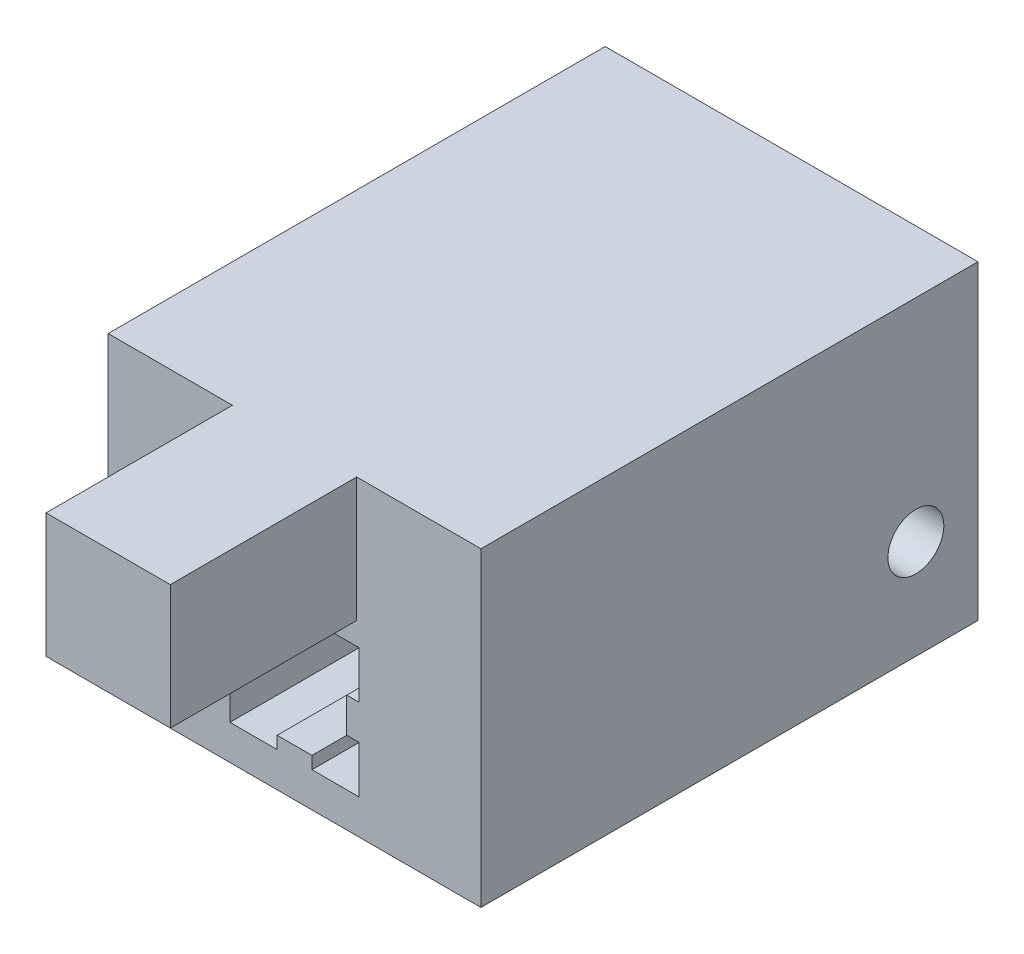
from build123d import *

# Parameters (mm, degrees)
ESQUISSE1_W             = 30
ESQUISSE1_H             = 25
BOSS_EXTRU_1_DEPTH      = 40
ENL_V_MAT_EXTRU_1_DEPTH = 45.511234537
ESQUISSE4_R             = 2.25
ENL_V_MAT_EXTRU_2_DEPTH = 8
ENL_V_START             = -8
ESQUISSE5_R             = 2.25
ENL_V_MAT_EXTRU_3_DEPTH = 8
ESQUISSE6_W             = 10
ESQUISSE6_H             = 10
BOSS_EXTRU_2_DEPTH      = 15


with BuildPart() as part:
    # Esquisse1 → Boss.-Extru.1 (new body)
    with BuildSketch(Plane.XY):
        Rectangle(ESQUISSE1_W, ESQUISSE1_H)
    extrude(amount=BOSS_EXTRU_1_DEPTH)

    # Esquisse3 → Enlèv. mat.-Extru.1 (cut, through all)
    with BuildSketch(Plane(origin=(0, 0, 0), x_dir=(-1, 0, 0), z_dir=(0, 0, -1))):
        Polygon((-5.2, 0.7), (-5.2, -3.1), (-4.2, -3.1), (-4.2, -5.9), (-5.2, -5.9), (-5.2, -9.7), (-1.4, -9.7), (-1.4, -8.7), (1.4, -8.7), (1.4, -9.7), (5.2, -9.7), (5.2, -5.9), (4.2, -5.9), (4.2, -3.1), (5.2, -3.1), (5.2, 0.7), (1.4, 0.7), (1.4, -0.3), (-1.4, -0.3), (-1.4, 0.7), align=None)
    extrude(amount=-ENL_V_MAT_EXTRU_1_DEPTH, mode=Mode.SUBTRACT)

    # Esquisse4 → Enlèv. mat.-Extru.2 (cut)
    with BuildSketch(Plane.ZY.offset(15)):
        with Locations(Location((5, -4.5, 0), (0, 0, 270))):
            Circle(ESQUISSE4_R)
    extrude(amount=-ENL_V_MAT_EXTRU_2_DEPTH, mode=Mode.SUBTRACT)

    # Esquisse5 → Enlèv. mat.-Extru.3 (cut)
    with BuildSketch(Plane(origin=(15, 0, 0), x_dir=(0, 0, -1), z_dir=(1, 0, 0)).offset(ENL_V_START)):
        with Locations(Location((-5, -4.5, 0), (0, 0, 270))):
            Circle(ESQUISSE5_R)
    extrude(amount=ENL_V_MAT_EXTRU_3_DEPTH, mode=Mode.SUBTRACT)

    # Esquisse6 → Boss.-Extru.2 (add)
    with BuildSketch(Plane.XY.offset(40)):
        with Locations((0, 7.5)):
            Rectangle(ESQUISSE6_W, ESQUISSE6_H)
    extrude(amount=BOSS_EXTRU_2_DEPTH)


solid = part.part
